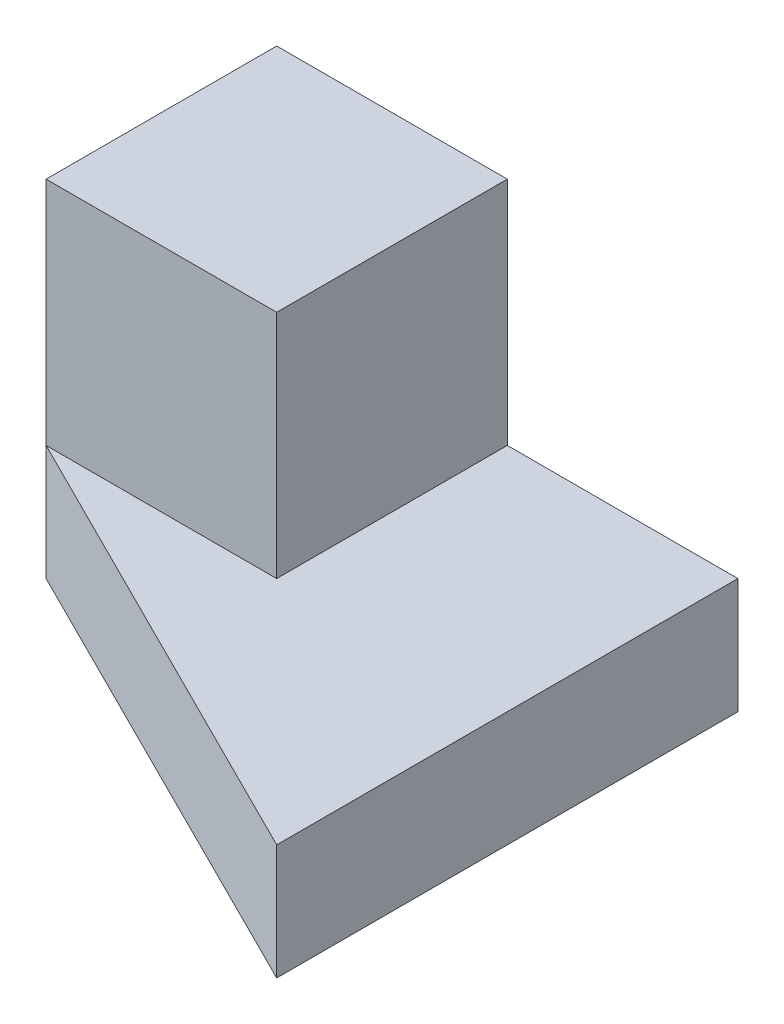
from build123d import *

# Parameters (mm, degrees)
BOSS_EXTRUDE1_DEPTH = 10
SKETCH2_3_W         = 20
SKETCH2_3_H         = 20
BOSS_EXTRUDE2_DEPTH = 30


with BuildPart() as part:
    # Sketch2 → Boss-Extrude1 (new body)
    with BuildSketch(Plane(origin=(0, 0, 0), x_dir=(1, 0, 0), z_dir=(0, 1, 0))):
        Polygon((-40, 20), (0, 0), (0, 40), (-20, 40), (-20, 20), align=None)
    extrude(amount=BOSS_EXTRUDE1_DEPTH)

    # Sketch2<3> → Boss-Extrude2 (add)
    with BuildSketch(Plane(origin=(0, 0, 0), x_dir=(1, 0, 0), z_dir=(0, 1, 0))):
        with Locations((-30, 30)):
            Rectangle(SKETCH2_3_W, SKETCH2_3_H)
    extrude(amount=BOSS_EXTRUDE2_DEPTH)


solid = part.part
